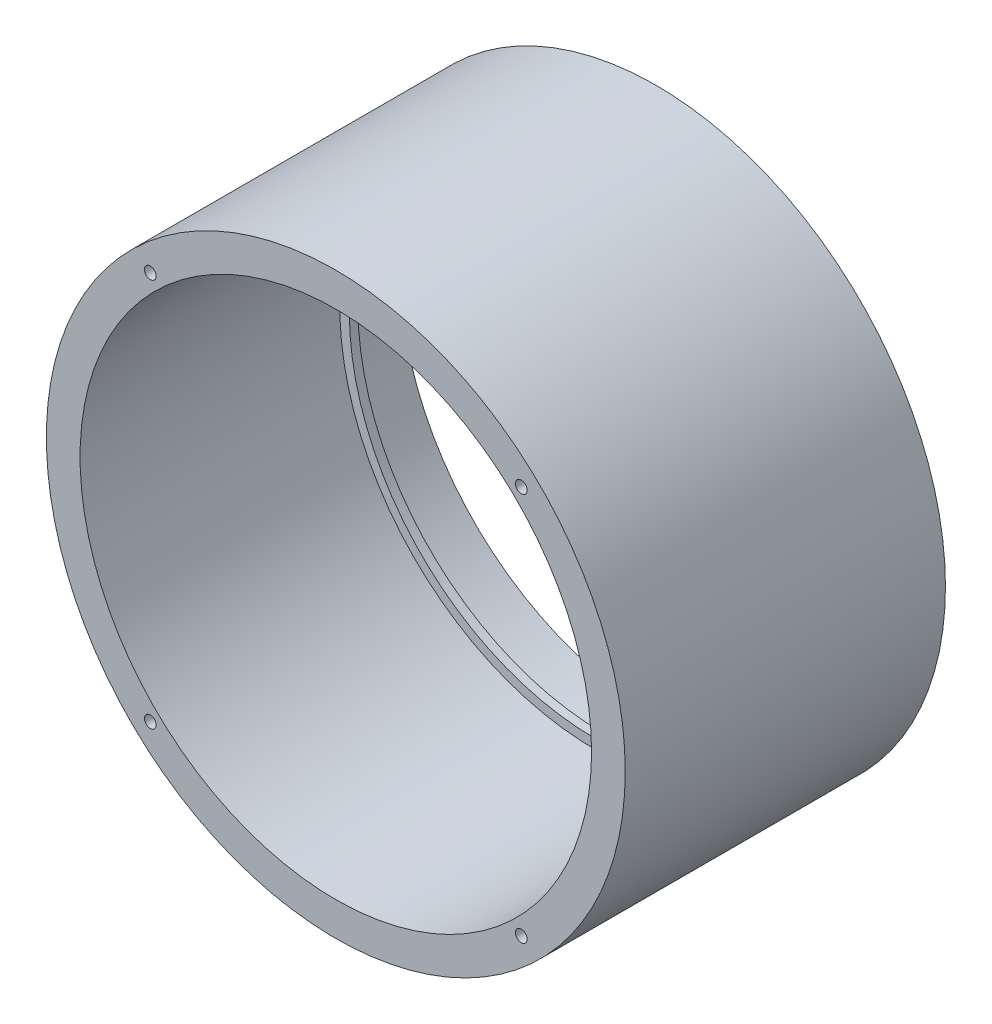
from build123d import *

# Parameters (mm, degrees)
IZIM1_R                     = 167.5
IZIM1_R_2                   = 148
Y_KSEKLIK_EKSTR_ZYON2_DEPTH = 185.3
IZIM9_R                     = 3.4
KES_EKSTR_ZYON1_DEPTH       = 15
IZIM10_W                    = 5
IZIM10_H                    = 16.407796145


with BuildPart() as part:
    # Çizim1 → Yükseklik-Ekstrüzyon2 (new body)
    with BuildSketch(Plane.XY):
        Circle(IZIM1_R)
        Circle(IZIM1_R_2, mode=Mode.SUBTRACT)
    extrude(amount=Y_KSEKLIK_EKSTR_ZYON2_DEPTH)

    # Çizim9 → Kes-Ekstrüzyon1 (cut)
    with BuildSketch(Plane(origin=(0, 0, 0), x_dir=(-1, 0, 0), z_dir=(0, 0, -1))):
        with Locations((107.349895203, -112.5)):
            Circle(IZIM9_R)
        with Locations((-107.349895203, -112.5)):
            Circle(IZIM9_R)
        with Locations((-107.349895203, 112.5)):
            Circle(IZIM9_R)
        with Locations((107.349895203, 112.5)):
            Circle(IZIM9_R)
    kes_ekstr_zyon1 = extrude(amount=-KES_EKSTR_ZYON1_DEPTH, mode=Mode.SUBTRACT)

    # Çizim10 → Döndür1 (revolve)
    with BuildSketch(Plane(origin=(0, 0, 0), x_dir=(0, 0, -1), z_dir=(1, 0, 0)), mode=Mode.PRIVATE) as d_nd_r1_sk:
        with Locations((-32.5, 150.703898073)):
            Rectangle(IZIM10_W, IZIM10_H)
    revolve(d_nd_r1_sk.sketch.rotate(Axis((0, 0, 0), (0, 0, 1)), 90), axis=Axis((0, 0, 0), (0, 0, 1)))

    # Aynalama1: Kes-Ekstrüzyon1 across plane
    add(kes_ekstr_zyon1.mirror(Plane(origin=(0, 0, 92.65), x_dir=(1, 0, 0), z_dir=(0, 0, -1))), mode=Mode.SUBTRACT)


solid = part.part
